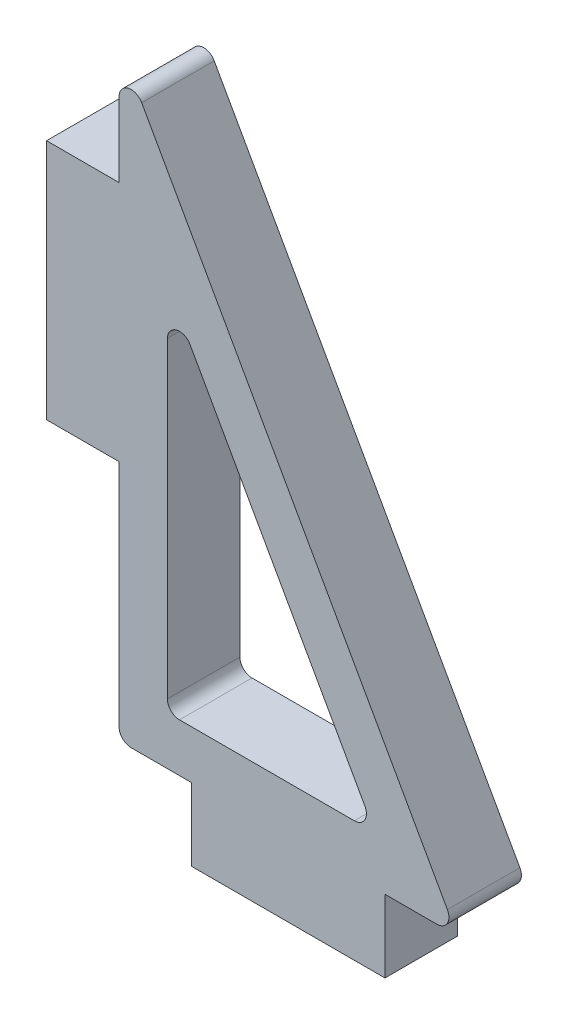
from build123d import *

# Parameters (mm, degrees)
EXTRUDE_2_DEPTH     = 3
CUT_EXTRUDE_1_DEPTH = 28.412321808


with BuildPart() as part:
    # 草图1 → 凸台-拉伸2 (new body)
    with BuildSketch(Plane.XY):
        with BuildLine():
            Line((0.5, 0), (3, 0))
            Line((3, 0), (3, -3))
            Line((3, -3), (11, -3))
            Line((11, -3), (11, 0))
            Line((11, 0), (13.146938049, 0))
            ThreePointArc((13.146938049, 0), (13.578302652, 0.247166895), (13.583191057, 0.744301684))
            Line((13.583191057, 0.744301684), (0.936253008, 23.328119629))
            ThreePointArc((0.936253008, 23.328119629), (0.373759167, 23.567618783), (0, 23.083817944))
            Line((0, 23.083817944), (0, 20))
            Line((0, 20), (-3, 20))
            Line((-3, 20), (-3, 10))
            Line((-3, 10), (0, 10))
            Line((0, 10), (0, 0.5))
            ThreePointArc((0, 0.5), (0.146446609, 0.146446609), (0.5, 0))
        make_face()
    extrude(amount=EXTRUDE_2_DEPTH)

    # 草图2 → 切除-拉伸1 (cut, through all)
    with BuildSketch(Plane.XY.offset(3)):
        with BuildLine():
            Line((2, 15.419089721), (2, 2.5))
            ThreePointArc((2, 2.5), (2.146446609, 2.146446609), (2.5, 2))
            Line((2.5, 2), (9.734690244, 2))
            ThreePointArc((9.734690244, 2), (10.166054847, 2.247166895), (10.170943252, 2.744301684))
            Line((10.170943252, 2.744301684), (2.936253008, 15.663391405))
            ThreePointArc((2.936253008, 15.663391405), (2.373759167, 15.90289056), (2, 15.419089721))
        make_face()
    extrude(amount=-CUT_EXTRUDE_1_DEPTH, mode=Mode.SUBTRACT)


solid = part.part
